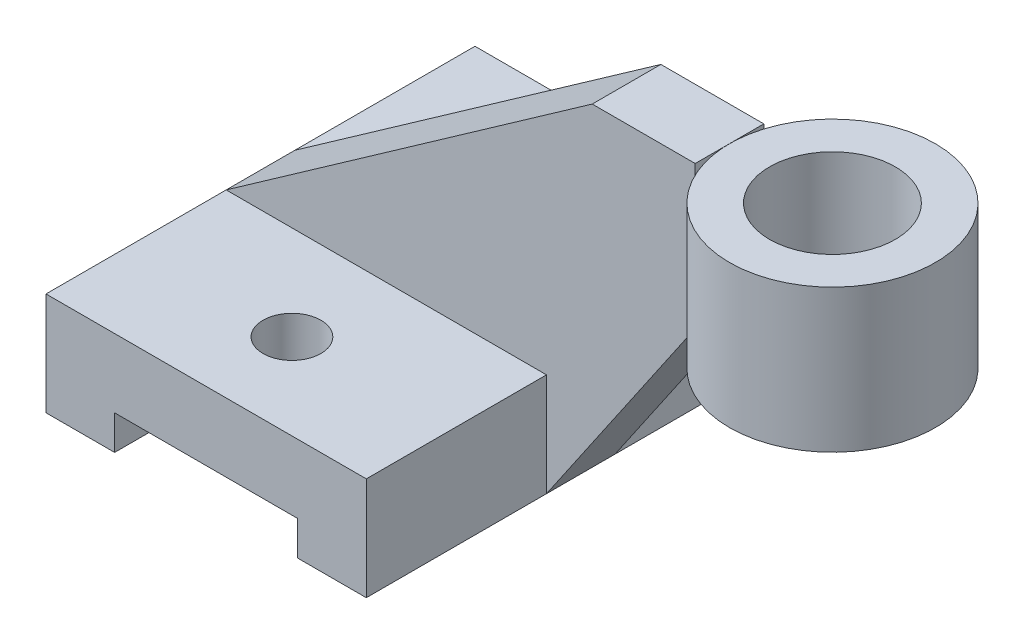
from build123d import *

# Parameters (mm, degrees)
SKETCH1_W           = 56
SKETCH1_H           = 75
BOSS_EXTRUDE1_DEPTH = 18
SKETCH2_W           = 32
SKETCH2_H           = 6
CUT_EXTRUDE1_DEPTH  = 83.054859698
SKETCH3_R           = 5.055841373
SKETCH3_R_2         = 5.630971307
CUT_EXTRUDE2_DEPTH  = 51.142297514
BOSS_EXTRUDE2_DEPTH = 12
SKETCH8_R           = 18
SKETCH8_R_2         = 11
BOSS_EXTRUDE3_DEPTH = 25
BOSS_EXTRUDE4_DEPTH = 12


with BuildPart() as part:
    # Sketch1 → Boss-Extrude1 (new body)
    with BuildSketch(Plane(origin=(0, 0, 0), x_dir=(1, 0, 0), z_dir=(0, 1, 0))):
        Rectangle(SKETCH1_W, SKETCH1_H)
    extrude(amount=BOSS_EXTRUDE1_DEPTH)

    # Sketch2 → Cut-Extrude1 (cut, through all)
    with BuildSketch(Plane.XY.offset(37.5)):
        with Locations((0, 3)):
            Rectangle(SKETCH2_W, SKETCH2_H)
    extrude(amount=-CUT_EXTRUDE1_DEPTH, mode=Mode.SUBTRACT)

    # Sketch3 → Cut-Extrude2 (cut, through all)
    with BuildSketch(Plane(origin=(0, 18, 0), x_dir=(1, 0, 0), z_dir=(0, 1, 0))):
        with Locations(Location((0, -22.5, 0), (0, 0, 270))):
            Circle(SKETCH3_R)
        with Locations(Location((0, 22.5, 0), (0, 0, 270))):
            Circle(SKETCH3_R_2)
    extrude(amount=-CUT_EXTRUDE2_DEPTH, mode=Mode.SUBTRACT)

    # Sketch4 → Boss-Extrude2 (add)
    with BuildSketch(Plane.XY.offset(6)):
        Polygon((-28, 18), (36, 63), (36, 18), align=None)
    extrude(amount=-BOSS_EXTRUDE2_DEPTH)

    # Sketch9 → Boss-Extrude4 (add)
    with BuildSketch(Plane.XY.offset(6)):
        Polygon((36, 63), (54, 63), (54, 38), (28, 0), (28, 18), (36, 18), align=None)
    extrude(amount=-BOSS_EXTRUDE4_DEPTH)


with BuildPart() as body_2:
    # Sketch8 → Boss-Extrude3 (new body)
    with BuildSketch(Plane.ZX.offset(63)):
        with Locations((0, 72)):
            Circle(SKETCH8_R)
        with Locations((0, 72)):
            Circle(SKETCH8_R_2, mode=Mode.SUBTRACT)
    extrude(amount=-BOSS_EXTRUDE3_DEPTH)


solid = Compound([part.part, body_2.part])
